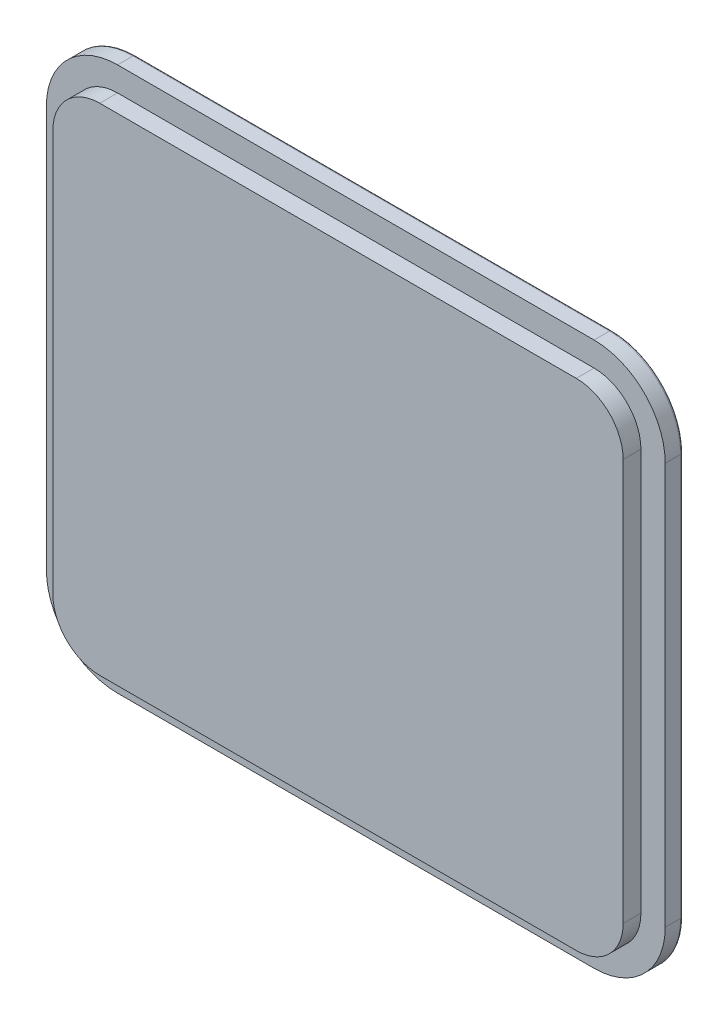
from build123d import *

# Parameters (mm, degrees)
BOSS_EXTRUDE3_DEPTH = 3
BOSS_EXTRUDE4_DEPTH = 1.5
FILLET1_R           = 0.2


with BuildPart() as part:
    # Sketch3 → Boss-Extrude3 (new body)
    with BuildSketch(Plane.XY):
        with BuildLine():
            Line((-25.35426057, 19.199439056), (-25.35426057, -14.681488353))
            ThreePointArc((-25.35426057, -14.681488353), (-24.197332356, -17.474560138), (-21.40426057, -18.631488353))
            Line((-21.40426057, -18.631488353), (18.774241414, -18.631488353))
            ThreePointArc((18.774241414, -18.631488353), (21.567313199, -17.474560138), (22.724241414, -14.681488353))
            Line((22.724241414, -14.681488353), (22.724241414, 19.199439056))
            ThreePointArc((22.724241414, 19.199439056), (21.567313199, 21.992510842), (18.774241414, 23.149439056))
            Line((18.774241414, 23.149439056), (-21.40426057, 23.149439056))
            ThreePointArc((-21.40426057, 23.149439056), (-24.197332356, 21.992510842), (-25.35426057, 19.199439056))
        make_face()
    extrude(amount=BOSS_EXTRUDE3_DEPTH)

    # Sketch3<4> → Boss-Extrude4 (add)
    with BuildSketch(Plane.XY):
        with BuildLine():
            Line((-27.40426057, 19.199439056), (-27.40426057, -14.681488353))
            ThreePointArc((-27.40426057, -14.681488353), (-25.646901258, -18.92412904), (-21.40426057, -20.681488353))
            Line((-21.40426057, -20.681488353), (18.774241414, -20.681488353))
            ThreePointArc((18.774241414, -20.681488353), (23.016882101, -18.92412904), (24.774241414, -14.681488353))
            Line((24.774241414, -14.681488353), (24.774241414, 19.199439056))
            ThreePointArc((24.774241414, 19.199439056), (23.016882101, 23.442079743), (18.774241414, 25.199439056))
            Line((18.774241414, 25.199439056), (-21.40426057, 25.199439056))
            ThreePointArc((-21.40426057, 25.199439056), (-25.646901258, 23.442079743), (-27.40426057, 19.199439056))
        make_face()
        with BuildLine():
            Line((-25.35426057, 19.199439056), (-25.35426057, -14.681488353))
            ThreePointArc((-25.35426057, -14.681488353), (-24.197332356, -17.474560138), (-21.40426057, -18.631488353))
            Line((-21.40426057, -18.631488353), (18.774241414, -18.631488353))
            ThreePointArc((18.774241414, -18.631488353), (21.567313199, -17.474560138), (22.724241414, -14.681488353))
            Line((22.724241414, -14.681488353), (22.724241414, 19.199439056))
            ThreePointArc((22.724241414, 19.199439056), (21.567313199, 21.992510842), (18.774241414, 23.149439056))
            Line((18.774241414, 23.149439056), (-21.40426057, 23.149439056))
            ThreePointArc((-21.40426057, 23.149439056), (-24.197332356, 21.992510842), (-25.35426057, 19.199439056))
        make_face(mode=Mode.SUBTRACT)
    extrude(amount=BOSS_EXTRUDE4_DEPTH)

    # Fillet1
    fillet1_edges = [part.edges().sort_by_distance(p)[0] for p in [
        (23.016882101, 23.442079743, 0),
        (24.774241414, 2.258975352, 0),
        (23.016882101, -18.92412904, 0),
        (-1.315009578, -20.681488353, 0),
        (-25.646901258, -18.92412904, 0),
        (-27.40426057, 2.258975352, 0),
        (-25.646901258, 23.442079743, 0),
        (-1.315009578, 25.199439056, 0),
    ]]
    fillet(fillet1_edges, radius=FILLET1_R)


solid = part.part
